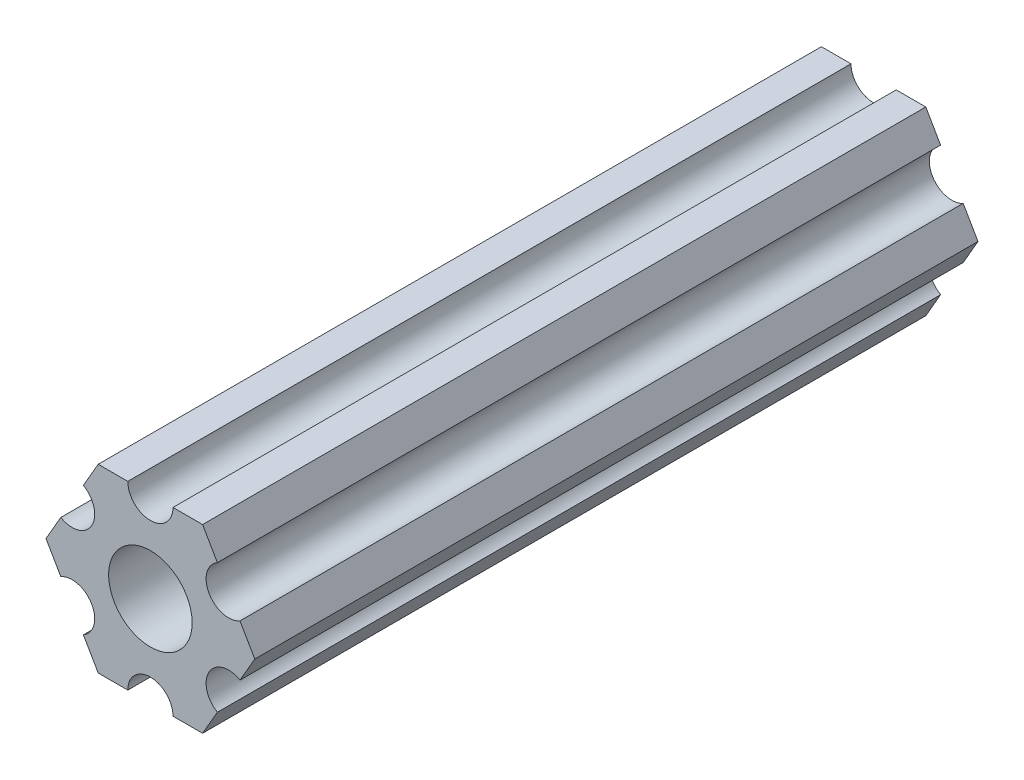
from build123d import *

# Parameters (mm, degrees)
SKETCH1_R           = 2.9337
BOSS_EXTRUDE1_DEPTH = 50.8


with BuildPart() as part:
    # Sketch1 → Boss-Extrude1 (new body)
    with BuildSketch(Plane(origin=(0, 0, 0), x_dir=(-1, 0, 0), z_dir=(0, 0, -1))):
        with BuildLine():
            Line((-4.70551159, -4.549815043), (-3.666174521, -6.349999904))
            Line((-3.666174521, -6.349999904), (-1.587500385, -6.349999904))
            ThreePointArc((-1.587500385, -6.349999904), (-3.85e-07, -4.762499904), (1.587499615, -6.349999904))
            Line((1.587499615, -6.349999904), (3.666173825, -6.349999904))
            Line((3.666173825, -6.349999904), (4.705510942, -4.54981524))
            ThreePointArc((4.705510942, -4.54981524), (4.124445629, -2.381249907), (6.293010962, -1.800184594))
            Line((6.293010962, -1.800184594), (7.332348079, 7e-08))
            Line((7.332348079, 7e-08), (6.293011217, 1.800184685))
            ThreePointArc((6.293011217, 1.800184685), (4.124445939, 2.381250203), (4.705511457, 4.549815481))
            Line((4.705511457, 4.549815481), (3.666174521, 6.350000222))
            Line((3.666174521, 6.350000222), (1.587500385, 6.350000222))
            ThreePointArc((1.587500385, 6.350000222), (3.85e-07, 4.762500222), (-1.587499615, 6.350000222))
            Line((-1.587499615, 6.350000222), (-3.666173825, 6.350000222))
            Line((-3.666173825, 6.350000222), (-4.705511038, 4.549815614))
            ThreePointArc((-4.705511038, 4.549815614), (-4.124445841, 2.38125025), (-6.293011205, 1.800185053))
            Line((-6.293011205, 1.800185053), (-7.332348419, 4.44e-07))
            Line((-7.332348419, 4.44e-07), (-6.293011423, -1.80018429))
            ThreePointArc((-6.293011423, -1.80018429), (-4.12444613, -2.38124975), (-4.70551159, -4.549815043))
        make_face()
        with Locations(Location((0, 0, 0), (0, 0, 180))):
            Circle(SKETCH1_R, mode=Mode.SUBTRACT)
    extrude(amount=BOSS_EXTRUDE1_DEPTH)


solid = part.part
